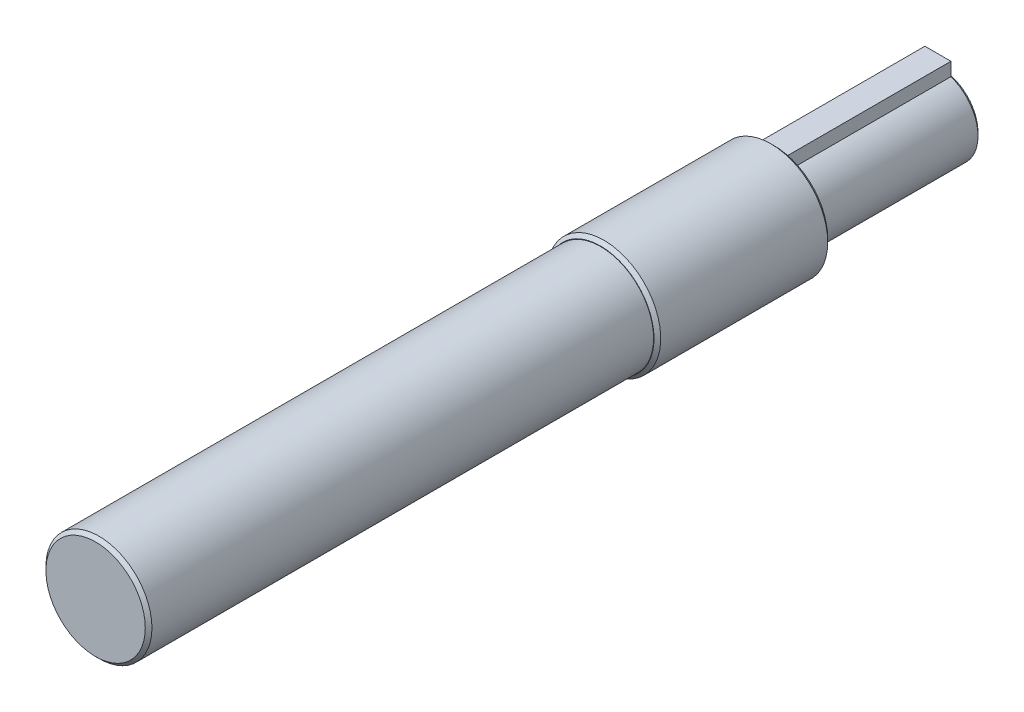
from build123d import *

# Parameters (mm, degrees)
SKETCH2_R           = 6
BOSS_EXTRUDE1_DEPTH = 25.4
BOSS_EXTRUDE2_START = 25
BOSS_EXTRUDE2_DEPTH = 25
SKETCH4_R           = 8.5
BOSS_EXTRUDE3_DEPTH = 26
SKETCH6_R           = 7.9375
BOSS_EXTRUDE4_DEPTH = 75.6
CHAMFER1_SIZE       = 0.5


with BuildPart() as part:
    # Sketch2 → Boss-Extrude1 (new body)
    with BuildSketch(Plane.XY):
        Circle(SKETCH2_R)
    extrude(amount=BOSS_EXTRUDE1_DEPTH)

    # Sketch3 → Boss-Extrude2 (add)
    with BuildSketch(Plane(origin=(0, 0, 0), x_dir=(-1, 0, 0), z_dir=(0, 0, -1)).offset(BOSS_EXTRUDE2_START)):
        with BuildLine():
            Line((-1.95, 5.674284096), (-1.95, 7.674284096))
            Line((-1.95, 7.674284096), (1.95, 7.674284096))
            Line((1.95, 7.674284096), (1.95, 5.674284096))
            ThreePointArc((1.95, 5.674284096), (0, -6), (-1.95, 5.674284096))
        make_face()
    extrude(amount=-BOSS_EXTRUDE2_DEPTH)

    # Sketch4 → Boss-Extrude3 (add)
    with BuildSketch(Plane.XY):
        with Locations(Location((0, 0, 0), (0, 0, 180))):
            Circle(SKETCH4_R)
    extrude(amount=BOSS_EXTRUDE3_DEPTH)

    # Sketch6 → Boss-Extrude4 (add)
    with BuildSketch(Plane.XY.offset(26)):
        Circle(SKETCH6_R)
    extrude(amount=BOSS_EXTRUDE4_DEPTH)

    # Chamfer1
    chamfer1_edges = [part.edges().sort_by_distance(p)[0] for p in [
        (8.5, 0, 0),
        (8.5, 0, 26),
        (-7.9375, 0, 101.6),
        (0, -6, -25),
        (-1.95, 6.674284096, -25),
        (0, 7.674284096, -25),
        (1.95, 6.674284096, -25),
    ]]
    chamfer(chamfer1_edges, length=CHAMFER1_SIZE)


solid = part.part
